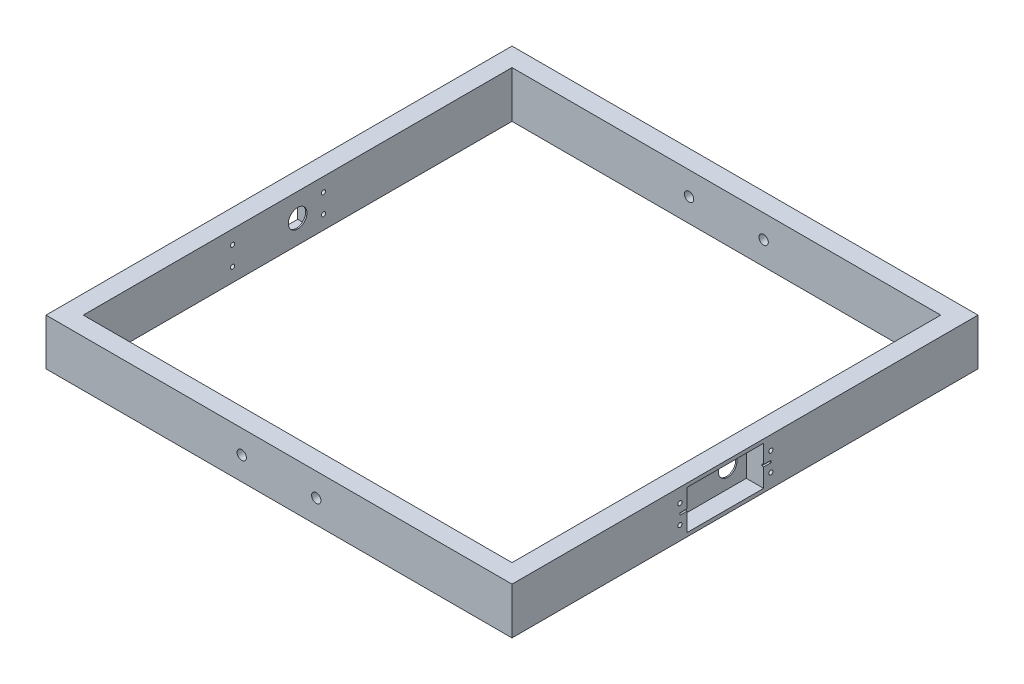
from build123d import *

# Parameters (mm, degrees)
SKETCH1_W                                  = 250
SKETCH1_H                                  = 250
BOSS_EXTRUDE1_DEPTH                        = 25
SKETCH2_W                                  = 230
SKETCH2_H                                  = 230
CUT_EXTRUDE1_DEPTH                         = 25
SKETCH19_W                                 = 41
SKETCH19_H                                 = 21
CUT_EXTRUDE10_DEPTH                        = 9.3
SKETCH20_R                                 = 5
CUT_EXTRUDE11_DEPTH                        = 9.3
SKETCH23_W                                 = 49
SKETCH23_H                                 = 1.1
CUT_EXTRUDE14_DEPTH                        = 1
SKETCH21_R                                 = 1.125
CUT_EXTRUDE12_DEPTH                        = 10
MIRROR1_AT_THE_SECOND_PLANE_COPY_1_SKETC_R = 1.125
MIRROR1_AT_THE_SECOND_PLANE_COPY_1_DEPTH   = 10
MIRROR2_COPY_1_SKETCH_R                    = 1.125
MIRROR2_COPY_1_DEPTH                       = 10
MIRROR2_COPY_2_SKETCH_R                    = 1.125
MIRROR2_COPY_2_DEPTH                       = 10
MIRROR2_COPY_3_SKETCH_R                    = 1.125
MIRROR2_COPY_3_DEPTH                       = 10
SKETCH22_R                                 = 2.5
CUT_EXTRUDE13_DEPTH                        = 281.624304008


with BuildPart() as part:
    # Sketch1 → Boss-Extrude1 (new body)
    with BuildSketch(Plane(origin=(0, 0, 0), x_dir=(1, 0, 0), z_dir=(0, 1, 0))):
        Rectangle(SKETCH1_W, SKETCH1_H)
    extrude(amount=BOSS_EXTRUDE1_DEPTH)

    # Sketch2 → Cut-Extrude1 (cut)
    with BuildSketch(Plane(origin=(0, 25, 0), x_dir=(1, 0, 0), z_dir=(0, 1, 0))):
        Rectangle(SKETCH2_W, SKETCH2_H)
    extrude(amount=-CUT_EXTRUDE1_DEPTH, mode=Mode.SUBTRACT)

    # Sketch19 → Cut-Extrude10 (cut)
    with BuildSketch(Plane.ZY.offset(125)):
        with Locations((10.5, 12.5)):
            Rectangle(SKETCH19_W, SKETCH19_H)
    cut_extrude10 = extrude(amount=-CUT_EXTRUDE10_DEPTH, mode=Mode.SUBTRACT)

    # Sketch20 → Cut-Extrude11 (cut)
    with BuildSketch(Plane.ZY.offset(115.7)):
        with Locations((0, 12.5)):
            Circle(SKETCH20_R)
    cut_extrude11 = extrude(amount=-CUT_EXTRUDE11_DEPTH, mode=Mode.SUBTRACT)

    # Sketch23 → Cut-Extrude14 (cut)
    with BuildSketch(Plane.ZY.offset(125)):
        with Locations((10.5, 12.5)):
            Rectangle(SKETCH23_W, SKETCH23_H)
    cut_extrude14 = extrude(amount=-CUT_EXTRUDE14_DEPTH, mode=Mode.SUBTRACT)

    # Sketch21 → Cut-Extrude12 (cut)
    with BuildSketch(Plane.ZY.offset(125)):
        with Locations((-13.9, 17.6)):
            Circle(SKETCH21_R)
    cut_extrude12 = extrude(amount=-CUT_EXTRUDE12_DEPTH, mode=Mode.SUBTRACT)

    # Mirror1: Cut-Extrude12 across plane
    add(cut_extrude12.mirror(Plane.XY.offset(10.5)), mode=Mode.SUBTRACT)

    # Mirror1 at the second plane: Cut-Extrude12 across plane
    add(cut_extrude12.mirror(Plane.ZX.offset(12.5)), mode=Mode.SUBTRACT)

    # Mirror1 at the second plane copy 1 sketc → Mirror1 at the second plane copy 1 (cut)
    with BuildSketch(Plane(origin=(-125, 25, 21), x_dir=(0, 0, -1), z_dir=(-1, 0, 0))):
        with Locations((-13.9, 17.6)):
            Circle(MIRROR1_AT_THE_SECOND_PLANE_COPY_1_SKETC_R)
    extrude(amount=-MIRROR1_AT_THE_SECOND_PLANE_COPY_1_DEPTH, mode=Mode.SUBTRACT)

    # Mirror2: Cut-Extrude10, Cut-Extrude11, Cut-Extrude14, Cut-Extrude12 across plane
    add(cut_extrude10.mirror(Plane.ZY), mode=Mode.SUBTRACT)
    add(cut_extrude11.mirror(Plane.ZY), mode=Mode.SUBTRACT)
    add(cut_extrude14.mirror(Plane.ZY), mode=Mode.SUBTRACT)
    add(cut_extrude12.mirror(Plane.ZY), mode=Mode.SUBTRACT)

    # Mirror2 copy 1 sketch → Mirror2 copy 1 (cut)
    with BuildSketch(Plane(origin=(125, 0, 21), x_dir=(0, 0, -1), z_dir=(1, 0, 0))):
        with Locations((-13.9, 17.6)):
            Circle(MIRROR2_COPY_1_SKETCH_R)
    extrude(amount=-MIRROR2_COPY_1_DEPTH, mode=Mode.SUBTRACT)

    # Mirror2 copy 2 sketch → Mirror2 copy 2 (cut)
    with BuildSketch(Plane(origin=(125, 25, 0), x_dir=(0, 0, 1), z_dir=(1, 0, 0))):
        with Locations((-13.9, 17.6)):
            Circle(MIRROR2_COPY_2_SKETCH_R)
    extrude(amount=-MIRROR2_COPY_2_DEPTH, mode=Mode.SUBTRACT)

    # Mirror2 copy 3 sketch → Mirror2 copy 3 (cut)
    with BuildSketch(Plane(origin=(125, 25, 21), x_dir=(0, 0, -1), z_dir=(1, 0, 0))):
        with Locations((-13.9, -17.6)):
            Circle(MIRROR2_COPY_3_SKETCH_R)
    extrude(amount=-MIRROR2_COPY_3_DEPTH, mode=Mode.SUBTRACT)

    # Sketch22 → Cut-Extrude13 (cut, through all)
    with BuildSketch(Plane.XY.offset(125)):
        with Locations((-20, 12.5)):
            Circle(SKETCH22_R)
        with Locations((20, 12.5)):
            Circle(SKETCH22_R)
    extrude(amount=-CUT_EXTRUDE13_DEPTH, mode=Mode.SUBTRACT)


solid = part.part
